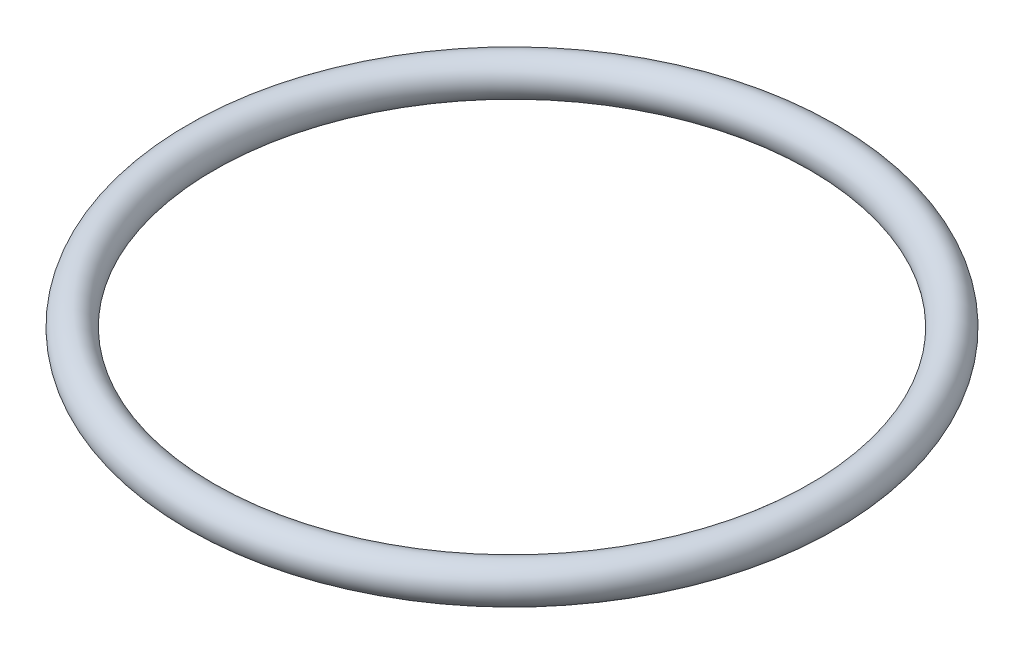
from build123d import *

# Parameters (mm, degrees)
SKETCH1_R = 2.5908


with BuildPart() as part:
    # Sketch1 → Revolve1 (revolve)
    with BuildSketch(Plane.XY, mode=Mode.PRIVATE) as revolve1_sk:
        with Locations((-43.5102, 0)):
            Circle(SKETCH1_R)
    revolve(revolve1_sk.sketch.rotate(Axis((0, 0, 0), (0, 1, 0)), 270), axis=Axis((0, 0, 0), (0, 1, 0)))


solid = part.part
